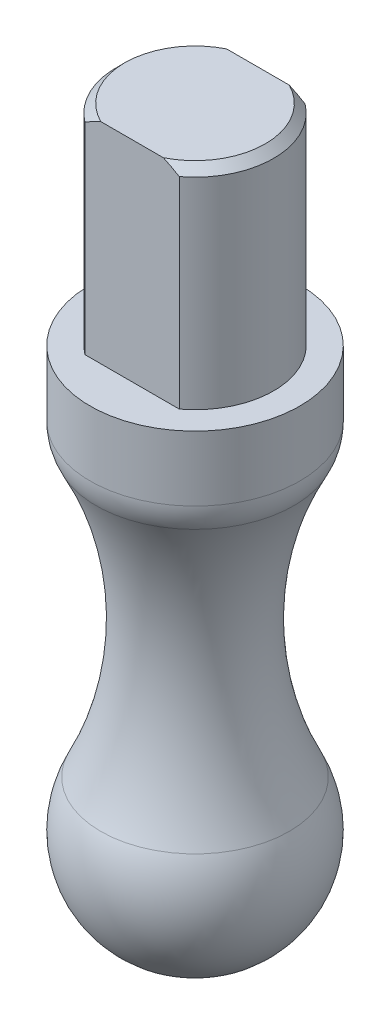
from build123d import *

# Parameters (mm, degrees)
CHAMFER1_SIZE      = 1.016
CUT_EXTRUDE1_DEPTH = 25.4


with BuildPart() as part:
    # Sketch1 → Revolve1 (revolve)
    with BuildSketch(Plane.XY, mode=Mode.PRIVATE) as revolve1_sk:
        with BuildLine():
            Line((9.525, 0), (0, 0))
            Line((0, 0), (0, -88.9))
            ThreePointArc((0, -88.9), (10.766948848, -82.935192091), (11.420073815, -70.64375))
            ThreePointArc((11.420073815, -70.64375), (7.585132399, -53.36790313), (11.968613609, -36.223027708))
            ThreePointArc((11.968613609, -36.223027708), (12.514442246, -34.788226477), (12.7, -33.264365659))
            Line((12.7, -33.264365659), (12.7, -25.4))
            Line((12.7, -25.4), (9.525, -25.4))
            Line((9.525, -25.4), (9.525, 0))
        make_face()
    revolve(revolve1_sk.sketch.rotate(Axis((0, 0, 0), (0, 1, 0)), 90), axis=Axis((0, 0, 0), (0, 1, 0)))

    # Chamfer1
    chamfer1_edges = [part.edges().sort_by_distance(p)[0] for p in [
        (0, 0, 9.525),
    ]]
    chamfer(chamfer1_edges, length=CHAMFER1_SIZE)

    # Sketch2 → Cut-Extrude1 (cut)
    with BuildSketch(Plane(origin=(0, 0, 0), x_dir=(-1, 0, 0), z_dir=(0, 1, 0))):
        with BuildLine():
            Line((-5.715, 7.62), (5.715, 7.62))
            ThreePointArc((5.715, 7.62), (0, 9.525), (-5.715, 7.62))
        make_face()
        with BuildLine():
            Line((-5.715, -7.62), (5.715, -7.62))
            ThreePointArc((5.715, -7.62), (0, -9.525), (-5.715, -7.62))
        make_face()
    extrude(amount=-CUT_EXTRUDE1_DEPTH, mode=Mode.SUBTRACT)


solid = part.part
